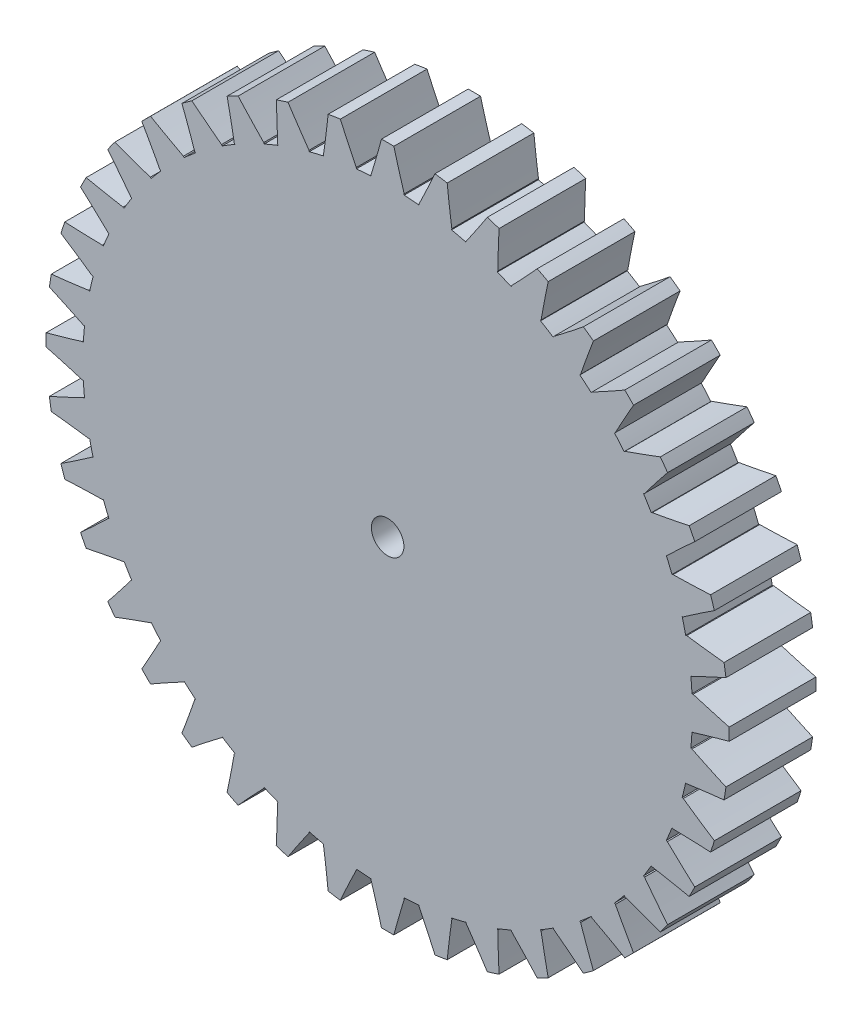
from build123d import *

# Parameters (mm, degrees)
SKETCH2_R           = 28.125
BOSS_EXTRUDE1_DEPTH = 8
BOSS_EXTRUDE4_DEPTH = 8
CIRPATTERN1_COUNT   = 40
SKETCH4_R           = 1.5
CUT_EXTRUDE1_DEPTH  = 46.294188341


with BuildPart() as part:
    # Sketch2 → Boss-Extrude1 (new body)
    with BuildSketch(Plane.XY):
        Circle(SKETCH2_R)
    extrude(amount=BOSS_EXTRUDE1_DEPTH)

    # Sketch3 → Boss-Extrude4 (add, through all)
    with BuildSketch(Plane.XY.offset(8)):
        with BuildLine():
            Line((0, 0), (1.528743868, 28.191))
            ThreePointArc((1.528743868, 28.191), (1.034788204, 29.850713746), (0.571079371, 31.51913097))
            ThreePointArc((0.571079371, 31.51913097), (0, 31.524304096), (-0.571079371, 31.51913097))
            ThreePointArc((-0.571079371, 31.51913097), (-1.034788204, 29.850713746), (-1.528743868, 28.191))
            Line((-1.528743868, 28.191), (0, 0))
        make_face()
    boss_extrude4 = extrude(amount=-BOSS_EXTRUDE4_DEPTH)

    # CirPattern1: Boss-Extrude4 ×40 about axis
    cirpattern1_axis = Axis((0, 0, 0), (0, 0, 1))
    for i in range(1, CIRPATTERN1_COUNT):
        add(boss_extrude4.rotate(cirpattern1_axis, i * 360 / CIRPATTERN1_COUNT))

    # Sketch4 → Cut-Extrude1 (cut, through all)
    with BuildSketch(Plane.XY.offset(8)):
        Circle(SKETCH4_R)
    extrude(amount=-CUT_EXTRUDE1_DEPTH, mode=Mode.SUBTRACT)


solid = part.part
